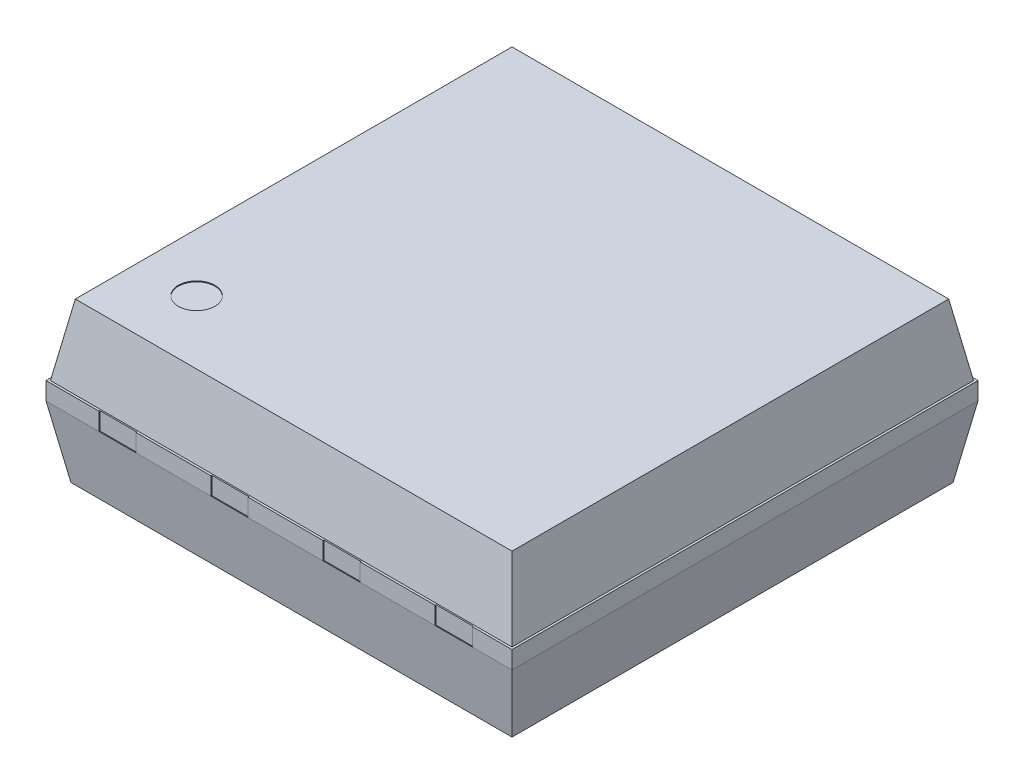
from build123d import *

# Parameters (mm, degrees)
SKETCH3_W           = 5.23
SKETCH3_H           = 5.23
BOSS_EXTRUDE1_DEPTH = 0.8
BOSS_EXTRUDE1_TAPER = 10
SKETCH4_W           = 5.28
SKETCH4_H           = 5.28
BOSS_EXTRUDE2_DEPTH = 0.2
SKETCH5_W           = 5.28
SKETCH5_H           = 5.28
BOSS_EXTRUDE3_DEPTH = 0.8
BOSS_EXTRUDE3_TAPER = 10
SKETCH6_R           = 0.207024854
CUT_EXTRUDE1_DEPTH  = 0.01
SKETCH8_W           = 0.42
SKETCH8_H           = 0.2
CUT_EXTRUDE2_DEPTH  = 0.01


with BuildPart() as part:
    # Sketch3 → Boss-Extrude1 (new body)
    with BuildSketch(Plane(origin=(0, 0, 0), x_dir=(1, 0, 0), z_dir=(0, 1, 0))):
        Rectangle(SKETCH3_W, SKETCH3_H)
    extrude(amount=BOSS_EXTRUDE1_DEPTH, taper=BOSS_EXTRUDE1_TAPER)

    # Sketch6 → Cut-Extrude1 (cut)
    with BuildSketch(Plane(origin=(0, 0.8, 0), x_dir=(1, 0, 0), z_dir=(0, 1, 0))):
        with Locations(Location((-1.818593304, -1.755006126, 0), (0, 0, 270))):
            Circle(SKETCH6_R)
    extrude(amount=-CUT_EXTRUDE1_DEPTH, mode=Mode.SUBTRACT)


with BuildPart() as body_2:
    # Sketch4 → Boss-Extrude2 (new body)
    with BuildSketch(Plane.XZ):
        Rectangle(SKETCH4_W, SKETCH4_H)
    extrude(amount=BOSS_EXTRUDE2_DEPTH)

    # Sketch8 → Cut-Extrude2 (cut)
    with BuildSketch(Plane.XY.offset(2.64)):
        with Locations((-1.83, -0.1)):
            Rectangle(SKETCH8_W, SKETCH8_H)
        with Locations((-0.56, -0.1)):
            Rectangle(SKETCH8_W, SKETCH8_H)
        with Locations((0.71, -0.1)):
            Rectangle(SKETCH8_W, SKETCH8_H)
        with Locations((1.98, -0.1)):
            Rectangle(SKETCH8_W, SKETCH8_H)
    cut_extrude2 = extrude(amount=-CUT_EXTRUDE2_DEPTH, mode=Mode.SUBTRACT)

    # Mirror1: Cut-Extrude2 across plane
    add(cut_extrude2.mirror(Plane.XY), mode=Mode.SUBTRACT)


with BuildPart() as body_3:
    # Sketch5 → Boss-Extrude3 (new body)
    with BuildSketch(Plane.XZ.offset(0.2)):
        Rectangle(SKETCH5_W, SKETCH5_H)
    extrude(amount=BOSS_EXTRUDE3_DEPTH, taper=BOSS_EXTRUDE3_TAPER)


solid = Compound([part.part, body_2.part, body_3.part])
